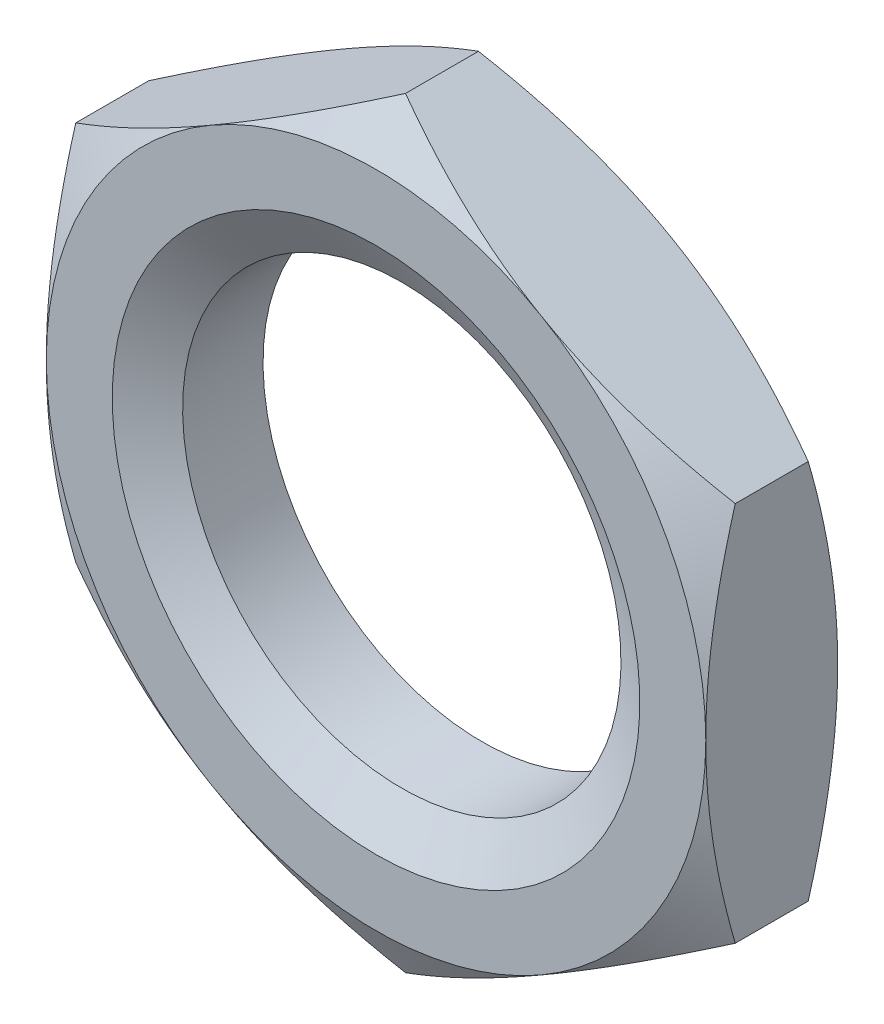
from build123d import *

# Parameters (mm, degrees)
SKETCH1_R           = 3.3235
BOSS_EXTRUDE1_DEPTH = 2


with BuildPart() as part:
    # Sketch1 → Boss-Extrude1 (new body)
    with BuildSketch(Plane.XY):
        Polygon((0, 5.773502692), (-5, 2.886751346), (-5, -2.886751346), (0, -5.773502692), (5, -2.886751346), (5, 2.886751346), align=None)
        Circle(SKETCH1_R, mode=Mode.SUBTRACT)
    extrude(amount=BOSS_EXTRUDE1_DEPTH)

    # Sketch2 → Cut-Revolve1 (revolve, cut)
    with BuildSketch(Plane(origin=(0, 0, 0), x_dir=(0, 0, -1), z_dir=(1, 0, 0))):
        Polygon((0, 5.773502692), (-0.446581987, 5.773502692), (0, 5), align=None)
        Polygon((0, 3.3235), (0, 4), (-0.390577457, 3.3235), align=None)
        Polygon((-1.609422543, 3.3235), (-2, 3.3235), (-2, 4), align=None)
        Polygon((-2, 5), (-2, 5.773502692), (-1.553418013, 5.773502692), align=None)
    revolve(axis=Axis((0, 0, 0), (0, 0, 1)), mode=Mode.SUBTRACT)


solid = part.part
